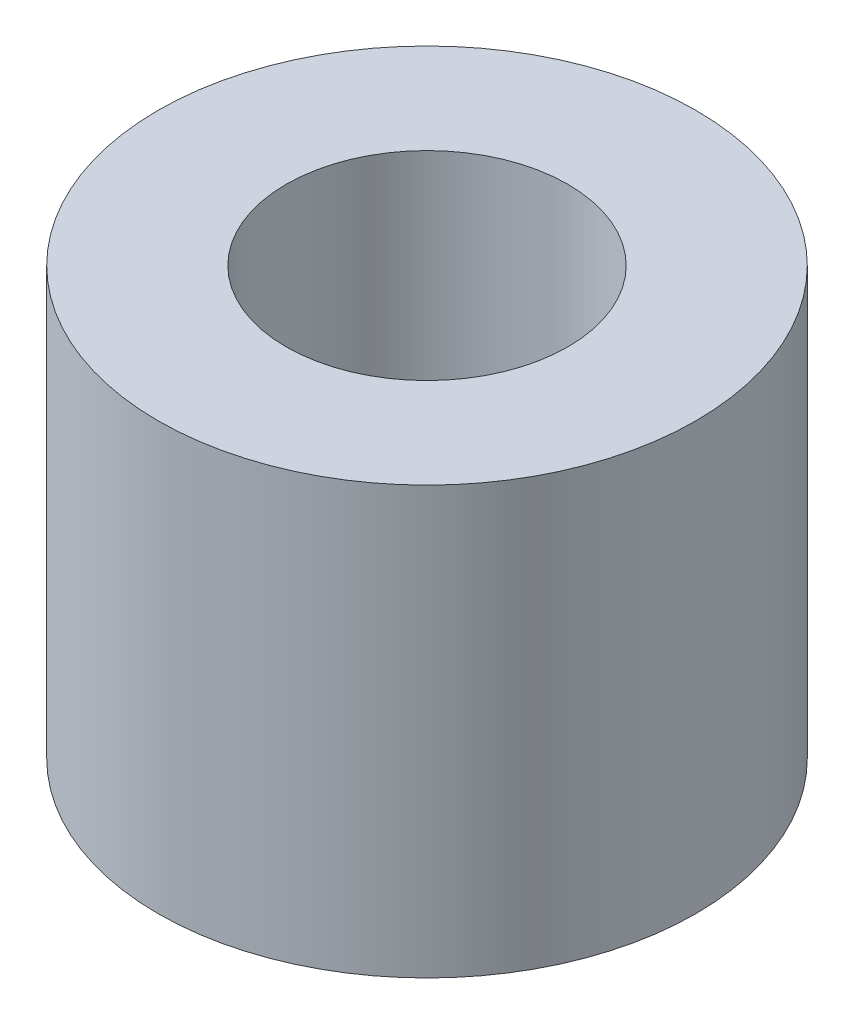
from build123d import *

# Parameters (mm, degrees)
CROQUIS1_R              = 6.3
CROQUIS1_R_2            = 3.3
SALIENTE_EXTRUIR1_DEPTH = 5


with BuildPart() as part:
    # Croquis1 → Saliente-Extruir1 (new, symmetric)
    with BuildSketch(Plane(origin=(0, 0, 0), x_dir=(1, 0, 0), z_dir=(0, 1, 0))):
        with Locations(Location((0, 0, 0), (0, 0, 270))):
            Circle(CROQUIS1_R)
        with Locations(Location((0, 0, 0), (0, 0, 270))):
            Circle(CROQUIS1_R_2, mode=Mode.SUBTRACT)
    extrude(amount=SALIENTE_EXTRUIR1_DEPTH, both=True)


solid = part.part
